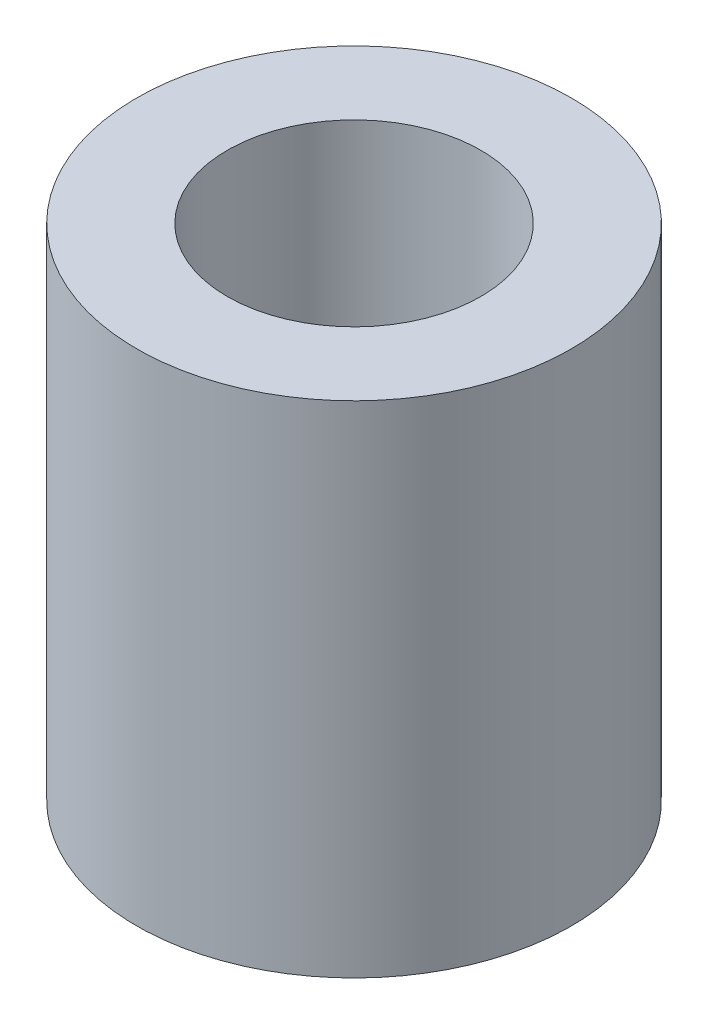
from build123d import *

# Parameters (mm, degrees)
SKETCH1_R           = 3
BOSS_EXTRUDE1_DEPTH = 6.9
SKETCH2_R           = 1.75
CUT_EXTRUDE1_DEPTH  = 9.1


with BuildPart() as part:
    # Sketch1 → Boss-Extrude1 (new body)
    with BuildSketch(Plane(origin=(0, 0, 0), x_dir=(1, 0, 0), z_dir=(0, 1, 0))):
        with Locations(Location((0, 0, 0), (0, 0, 90))):
            Circle(SKETCH1_R)
    extrude(amount=BOSS_EXTRUDE1_DEPTH)

    # Sketch2 → Cut-Extrude1 (cut, through all)
    with BuildSketch(Plane(origin=(0, 6.9, 0), x_dir=(1, 0, 0), z_dir=(0, 1, 0))):
        with Locations(Location((0, 0, 0), (0, 0, 270))):
            Circle(SKETCH2_R)
    extrude(amount=-CUT_EXTRUDE1_DEPTH, mode=Mode.SUBTRACT)


solid = part.part
